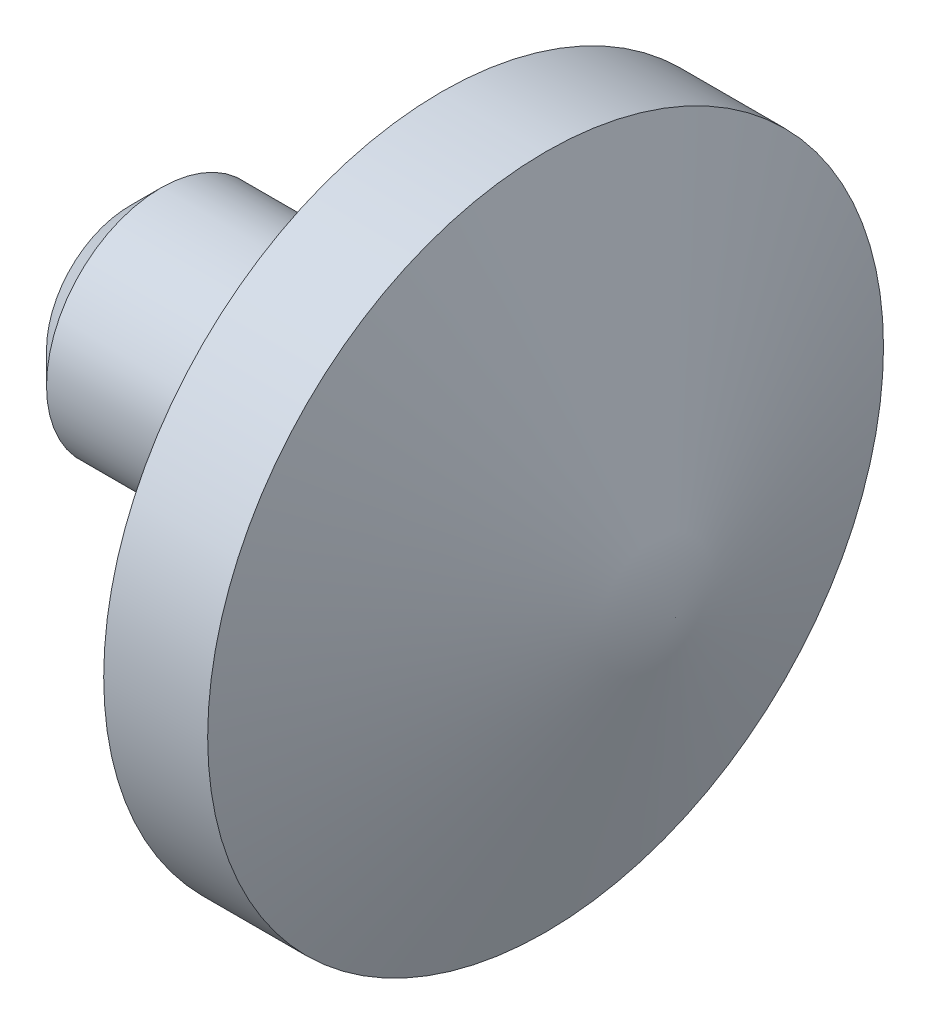
from build123d import *

# Parameters (mm, degrees)
CHAMFER2_SIZE = 0.3


with BuildPart() as part:
    # Sketch1 → Revolve1 (revolve)
    with BuildSketch(Plane.XY, mode=Mode.PRIVATE) as revolve1_sk:
        Polygon((2.25, 0), (1, 3.25), (0, 3.25), (0, 1.1), (-3, 1.1), (-3, 0), (0, 0), align=None)
    revolve(revolve1_sk.sketch.rotate(Axis((0, 0, 0), (-1, 0, 0)), 90), axis=Axis((0, 0, 0), (-1, 0, 0)))

    # Chamfer2
    chamfer2_edges = [part.edges().sort_by_distance(p)[0] for p in [
        (-3, 0, 1.1),
    ]]
    chamfer(chamfer2_edges, length=CHAMFER2_SIZE)


solid = part.part
